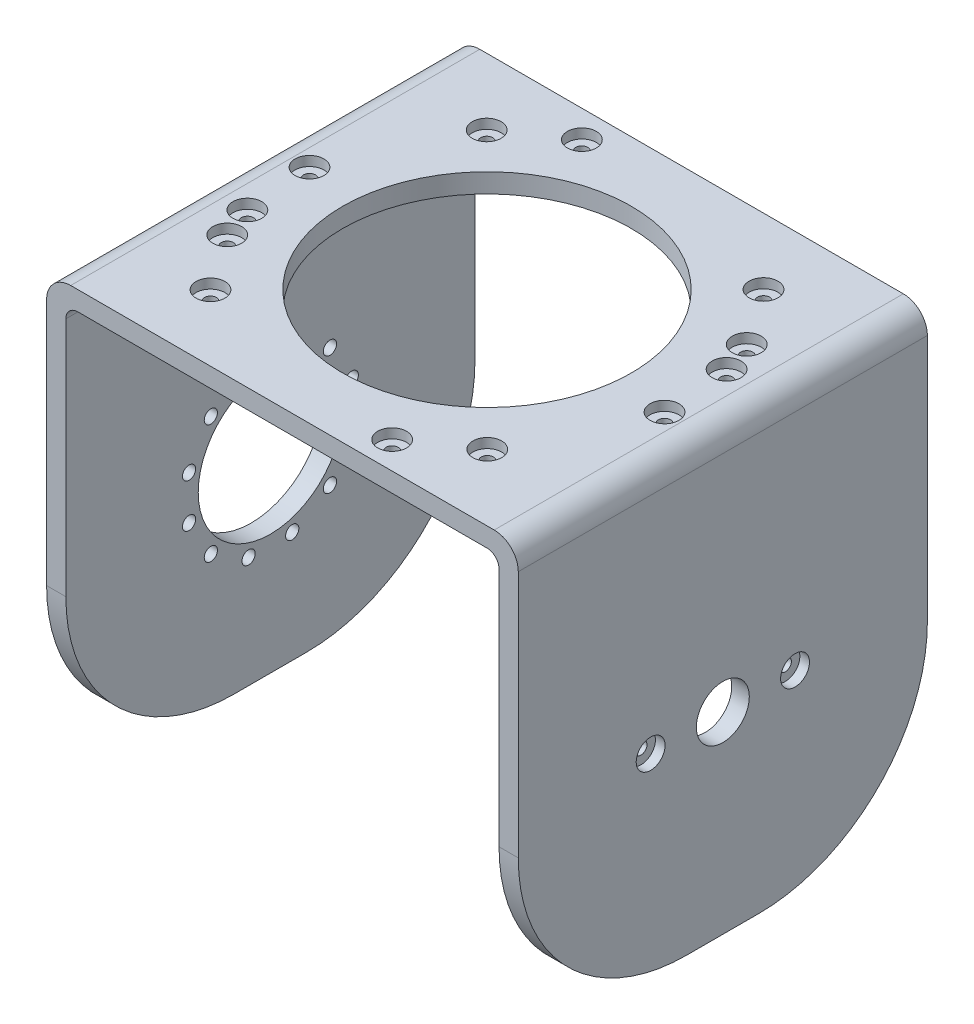
from build123d import *

# Parameters (mm, degrees)
EXTRUDE_1_DEPTH          = 170
SKETCH_2_R               = 60
CUT_EXTRUDE_1_DEPTH      = 180
CUT_EXTRUDE_2_DEPTH      = 313.955268369
CUT_EXTRUDE_2_DEPTH_BACK = 313.955268369
SKETCH_3_R               = 11
FILLET_1_R               = 70
FILLET_2_R               = 5
FILLET_3_R               = 10
SKETCH_6_R               = 30
CUT_EXTRUDE_6_DEPTH      = 39
SKETCH_7_R               = 13
CUT_EXTRUDE_7_DEPTH      = 0.7
SKETCH_8_R               = 2.5
CUT_EXTRUDE_8_DEPTH      = 10
SKETCH_9_R               = 6
CUT_EXTRUDE_9_DEPTH      = 4
SKETCH_10_R              = 2.5
CUT_EXTRUDE_10_DEPTH     = 10
CUT_EXTRUDE_START        = -4
SKETCH_11_R              = 6
SKETCH_11_R_2            = 2.5
CUT_EXTRUDE_11_DEPTH     = 4
SKETCH_12_R              = 2.75
CUT_EXTRUDE_12_DEPTH     = 10


with BuildPart() as part:
    # 草图1 → 凸台-拉伸1 (new body)
    with BuildSketch(Plane.XY):
        Polygon((-180, 0), (0, 0), (0, -175), (8, -175), (8, 8), (-180, 8), (-188, 8), (-188, -175), (-180, -175), align=None)
    extrude(amount=EXTRUDE_1_DEPTH)

    # 草图2 → 切除-拉伸1 (cut)
    with BuildSketch(Plane(origin=(0, 8, 0), x_dir=(1, 0, 0), z_dir=(0, 1, 0))):
        with Locations(Location((-90, -85, 0), (0, 0, 180))):
            Circle(SKETCH_2_R)
    extrude(amount=-CUT_EXTRUDE_1_DEPTH, mode=Mode.SUBTRACT)

    # 草图3 → 切除-拉伸2 (cut, two sides: drawn at the far end of the back side and taken through both)
    with BuildSketch(Plane(origin=(8, 0, 0), x_dir=(0, 0, -1), z_dir=(1, 0, 0)).offset(-CUT_EXTRUDE_2_DEPTH_BACK)):
        with Locations(Location((-85, -95, 0), (0, 0, 90))):
            Circle(SKETCH_3_R)
    extrude(amount=CUT_EXTRUDE_2_DEPTH + CUT_EXTRUDE_2_DEPTH_BACK, mode=Mode.SUBTRACT)

    # 圆角1
    fillet_1_edges = [part.edges().sort_by_distance(p)[0] for p in [
        (4, -175, 0),
        (4, -175, 170),
        (-184, -175, 170),
        (-184, -175, 0),
    ]]
    fillet(fillet_1_edges, radius=FILLET_1_R)

    # 圆角2
    fillet_2_edges = [part.edges().sort_by_distance(p)[0] for p in [
        (0, 0, 85),
        (-180, 0, 85),
    ]]
    fillet(fillet_2_edges, radius=FILLET_2_R)

    # 圆角3
    fillet_3_edges = [part.edges().sort_by_distance(p)[0] for p in [
        (-188, 8, 85),
        (8, 8, 85),
    ]]
    fillet(fillet_3_edges, radius=FILLET_3_R)

    # 草图6 → 切除-拉伸6 (cut)
    with BuildSketch(Plane.ZY.offset(188)):
        with Locations(Location((85, -95, 0), (0, 0, 270))):
            Circle(SKETCH_6_R)
    extrude(amount=-CUT_EXTRUDE_6_DEPTH, mode=Mode.SUBTRACT)

    # 草图7 → 切除-拉伸7 (cut)
    with BuildSketch(Plane.ZY):
        with Locations(Location((85, -95, 0), (0, 0, 270))):
            Circle(SKETCH_7_R)
    extrude(amount=-CUT_EXTRUDE_7_DEPTH, mode=Mode.SUBTRACT)

    # 草图8 → 切除-拉伸8 (cut)
    with BuildSketch(Plane(origin=(8, 0, 0), x_dir=(0, 0, -1), z_dir=(1, 0, 0))):
        with Locations(Location((-55, -95, 0), (0, 0, 90))):
            Circle(SKETCH_8_R)
        with Locations(Location((-115, -95, 0), (0, 0, 90))):
            Circle(SKETCH_8_R)
    extrude(amount=-CUT_EXTRUDE_8_DEPTH, mode=Mode.SUBTRACT)

    # 草图9 → 切除-拉伸9 (cut)
    with BuildSketch(Plane(origin=(8, 0, 0), x_dir=(0, 0, -1), z_dir=(1, 0, 0))):
        with Locations(Location((-55, -95, 0), (0, 0, 90))):
            Circle(SKETCH_9_R)
        with Locations(Location((-115, -95, 0), (0, 0, 90))):
            Circle(SKETCH_9_R)
    extrude(amount=-CUT_EXTRUDE_9_DEPTH, mode=Mode.SUBTRACT)

    # 草图10 → 切除-拉伸10 (cut)
    with BuildSketch(Plane.XZ):
        with Locations(Location((-55.742253069, 158.674753309, 0), (0, 0, 270))):
            Circle(SKETCH_10_R)
        with Locations(Location((-32.485217492, 142.390001682, 0), (0, 0, 270))):
            Circle(SKETCH_10_R)
        with Locations(Location((-9.066918551, 92.169297536, 0), (0, 0, 270))):
            Circle(SKETCH_10_R)
        with Locations(Location((-11.541409366, 63.885738097, 0), (0, 0, 270))):
            Circle(SKETCH_10_R)
        with Locations(Location((-16.325246691, 50.742253069, 0), (0, 0, 270))):
            Circle(SKETCH_10_R)
        with Locations(Location((-32.609998318, 27.485217492, 0), (0, 0, 270))):
            Circle(SKETCH_10_R)
        with Locations(Location((-124.257746931, 11.325246691, 0), (0, 0, 270))):
            Circle(SKETCH_10_R)
        with Locations(Location((-147.514782508, 27.609998318, 0), (0, 0, 270))):
            Circle(SKETCH_10_R)
        with Locations(Location((-170.933081449, 77.830702464, 0), (0, 0, 270))):
            Circle(SKETCH_10_R)
        with Locations(Location((-168.458590634, 106.114261903, 0), (0, 0, 270))):
            Circle(SKETCH_10_R)
        with Locations(Location((-163.674753309, 119.257746931, 0), (0, 0, 270))):
            Circle(SKETCH_10_R)
        with Locations(Location((-147.390001682, 142.514782508, 0), (0, 0, 270))):
            Circle(SKETCH_10_R)
    extrude(amount=-CUT_EXTRUDE_10_DEPTH, mode=Mode.SUBTRACT)

    # 草图11 → 切除-拉伸11 (cut)
    # profile 1 of 12: a face of its own
    with BuildSketch(Plane(origin=(0, 8, 0), x_dir=(1, 0, 0), z_dir=(0, 1, 0)).offset(CUT_EXTRUDE_START)):
        with Locations(Location((-32.485217492, -142.390001682, 0), (0, 0, 180))):
            Circle(SKETCH_11_R)
        with Locations(Location((-32.485217492, -142.390001682, 0), (0, 0, 90))):
            Circle(SKETCH_11_R_2, mode=Mode.SUBTRACT)
    # profile 2 of 12: a face of its own
    with BuildSketch(Plane(origin=(0, 8, 0), x_dir=(1, 0, 0), z_dir=(0, 1, 0)).offset(CUT_EXTRUDE_START)):
        with Locations(Location((-55.742253069, -158.674753309, 0), (0, 0, 180))):
            Circle(SKETCH_11_R)
        with Locations(Location((-55.742253069, -158.674753309, 0), (0, 0, 90))):
            Circle(SKETCH_11_R_2, mode=Mode.SUBTRACT)
    # profile 3 of 12: a face of its own
    with BuildSketch(Plane(origin=(0, 8, 0), x_dir=(1, 0, 0), z_dir=(0, 1, 0)).offset(CUT_EXTRUDE_START)):
        with Locations(Location((-147.390001682, -142.514782508, 0), (0, 0, 180))):
            Circle(SKETCH_11_R)
        with Locations(Location((-147.390001682, -142.514782508, 0), (0, 0, 90))):
            Circle(SKETCH_11_R_2, mode=Mode.SUBTRACT)
    # profile 4 of 12: a face of its own
    with BuildSketch(Plane(origin=(0, 8, 0), x_dir=(1, 0, 0), z_dir=(0, 1, 0)).offset(CUT_EXTRUDE_START)):
        with Locations(Location((-163.674753309, -119.257746931, 0), (0, 0, 180))):
            Circle(SKETCH_11_R)
        with Locations(Location((-163.674753309, -119.257746931, 0), (0, 0, 90))):
            Circle(SKETCH_11_R_2, mode=Mode.SUBTRACT)
    # profile 5 of 12: a face of its own
    with BuildSketch(Plane(origin=(0, 8, 0), x_dir=(1, 0, 0), z_dir=(0, 1, 0)).offset(CUT_EXTRUDE_START)):
        with Locations(Location((-168.458590634, -106.114261903, 0), (0, 0, 180))):
            Circle(SKETCH_11_R)
        with Locations(Location((-168.458590634, -106.114261903, 0), (0, 0, 90))):
            Circle(SKETCH_11_R_2, mode=Mode.SUBTRACT)
    # profile 6 of 12: a face of its own
    with BuildSketch(Plane(origin=(0, 8, 0), x_dir=(1, 0, 0), z_dir=(0, 1, 0)).offset(CUT_EXTRUDE_START)):
        with Locations(Location((-170.933081449, -77.830702464, 0), (0, 0, 180))):
            Circle(SKETCH_11_R)
        with Locations(Location((-170.933081449, -77.830702464, 0), (0, 0, 90))):
            Circle(SKETCH_11_R_2, mode=Mode.SUBTRACT)
    # profile 7 of 12: a face of its own
    with BuildSketch(Plane(origin=(0, 8, 0), x_dir=(1, 0, 0), z_dir=(0, 1, 0)).offset(CUT_EXTRUDE_START)):
        with Locations(Location((-147.514782508, -27.609998318, 0), (0, 0, 180))):
            Circle(SKETCH_11_R)
        with Locations(Location((-147.514782508, -27.609998318, 0), (0, 0, 90))):
            Circle(SKETCH_11_R_2, mode=Mode.SUBTRACT)
    # profile 8 of 12: a face of its own
    with BuildSketch(Plane(origin=(0, 8, 0), x_dir=(1, 0, 0), z_dir=(0, 1, 0)).offset(CUT_EXTRUDE_START)):
        with Locations(Location((-124.257746931, -11.325246691, 0), (0, 0, 180))):
            Circle(SKETCH_11_R)
        with Locations(Location((-124.257746931, -11.325246691, 0), (0, 0, 90))):
            Circle(SKETCH_11_R_2, mode=Mode.SUBTRACT)
    # profile 9 of 12: a face of its own
    with BuildSketch(Plane(origin=(0, 8, 0), x_dir=(1, 0, 0), z_dir=(0, 1, 0)).offset(CUT_EXTRUDE_START)):
        with Locations(Location((-32.609998318, -27.485217492, 0), (0, 0, 180))):
            Circle(SKETCH_11_R)
        with Locations(Location((-32.609998318, -27.485217492, 0), (0, 0, 90))):
            Circle(SKETCH_11_R_2, mode=Mode.SUBTRACT)
    # profile 10 of 12: a face of its own
    with BuildSketch(Plane(origin=(0, 8, 0), x_dir=(1, 0, 0), z_dir=(0, 1, 0)).offset(CUT_EXTRUDE_START)):
        with Locations(Location((-16.325246691, -50.742253069, 0), (0, 0, 180))):
            Circle(SKETCH_11_R)
        with Locations(Location((-16.325246691, -50.742253069, 0), (0, 0, 90))):
            Circle(SKETCH_11_R_2, mode=Mode.SUBTRACT)
    # profile 11 of 12: a face of its own
    with BuildSketch(Plane(origin=(0, 8, 0), x_dir=(1, 0, 0), z_dir=(0, 1, 0)).offset(CUT_EXTRUDE_START)):
        with Locations(Location((-11.541409366, -63.885738097, 0), (0, 0, 180))):
            Circle(SKETCH_11_R)
        with Locations(Location((-11.541409366, -63.885738097, 0), (0, 0, 90))):
            Circle(SKETCH_11_R_2, mode=Mode.SUBTRACT)
    # profile 12 of 12: a face of its own
    with BuildSketch(Plane(origin=(0, 8, 0), x_dir=(1, 0, 0), z_dir=(0, 1, 0)).offset(CUT_EXTRUDE_START)):
        with Locations(Location((-9.066918551, -92.169297536, 0), (0, 0, 180))):
            Circle(SKETCH_11_R)
        with Locations(Location((-9.066918551, -92.169297536, 0), (0, 0, 90))):
            Circle(SKETCH_11_R_2, mode=Mode.SUBTRACT)
    extrude(amount=CUT_EXTRUDE_11_DEPTH, mode=Mode.SUBTRACT)

    # 草图12 → 切除-拉伸12 (cut)
    with BuildSketch(Plane.ZY.offset(188)):
        with Locations(Location((94.058666579, -128.80740392, 0), (0, 0, 270))):
            Circle(SKETCH_12_R)
        with Locations(Location((75.941333421, -128.80740392, 0), (0, 0, 270))):
            Circle(SKETCH_12_R)
        with Locations(Location((60.251262658, -119.748737342, 0), (0, 0, 270))):
            Circle(SKETCH_12_R)
        with Locations(Location((51.19259608, -104.058666579, 0), (0, 0, 270))):
            Circle(SKETCH_12_R)
        with Locations(Location((51.19259608, -85.941333421, 0), (0, 0, 270))):
            Circle(SKETCH_12_R)
        with Locations(Location((60.251262658, -70.251262658, 0), (0, 0, 270))):
            Circle(SKETCH_12_R)
        with Locations(Location((75.941333421, -61.19259608, 0), (0, 0, 270))):
            Circle(SKETCH_12_R)
        with Locations(Location((94.058666579, -61.19259608, 0), (0, 0, 270))):
            Circle(SKETCH_12_R)
        with Locations(Location((109.748737342, -70.251262658, 0), (0, 0, 270))):
            Circle(SKETCH_12_R)
        with Locations(Location((118.80740392, -85.941333421, 0), (0, 0, 270))):
            Circle(SKETCH_12_R)
        with Locations(Location((118.80740392, -104.058666579, 0), (0, 0, 270))):
            Circle(SKETCH_12_R)
        with Locations(Location((109.748737342, -119.748737342, 0), (0, 0, 270))):
            Circle(SKETCH_12_R)
    extrude(amount=-CUT_EXTRUDE_12_DEPTH, mode=Mode.SUBTRACT)


solid = part.part
